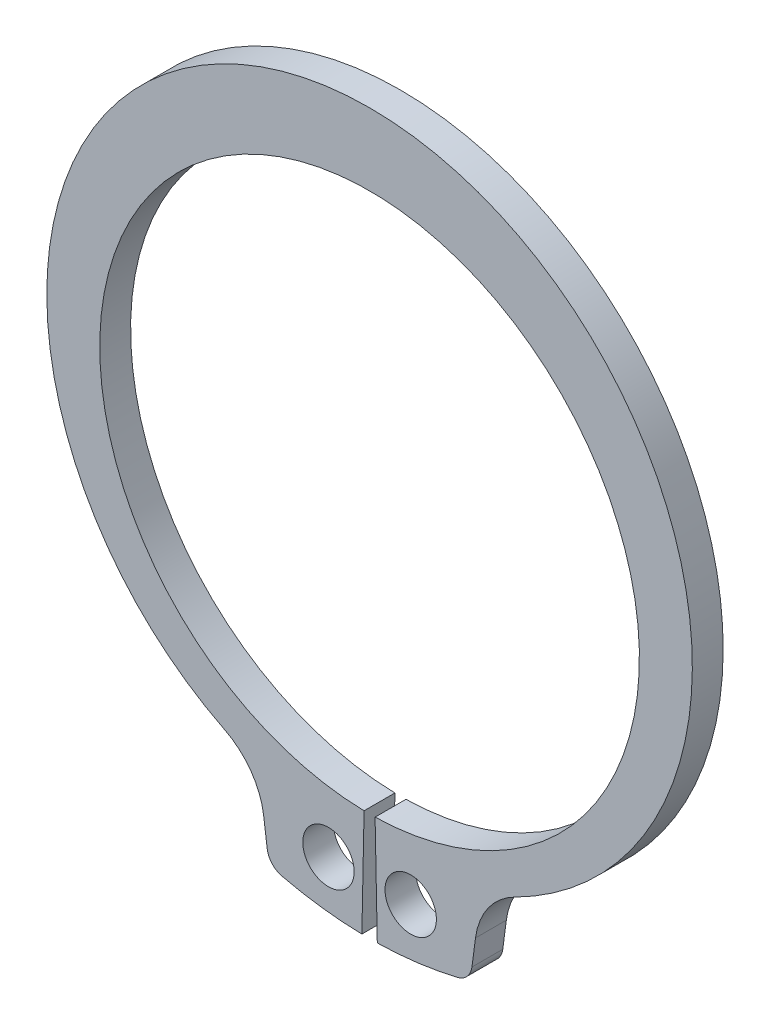
from build123d import *

# Parameters (mm, degrees)
BODYSKE_R  = 1
BODY_DEPTH = 1.2


with BuildPart() as part:
    # BodySke → Body (new body)
    with BuildSketch(Plane.XY):
        with BuildLine():
            Line((0.214285714, -10.497813183), (0.3, -14.696938457))
            ThreePointArc((0.3, -14.696938457), (1.86755937, -14.580885501), (3.413765605, -14.298118911))
            ThreePointArc((3.413765605, -14.298118911), (3.796638548, -14.070819474), (3.983177537, -13.666517692))
            Line((3.983177537, -13.666517692), (4.121423858, -12.616432629))
            ThreePointArc((4.121423858, -12.616432629), (4.615201874, -11.359967763), (5.639656061, -10.480755443))
            ThreePointArc((5.639656061, -10.480755443), (0, 13.3), (-5.639656061, -10.480755443))
            ThreePointArc((-5.639656061, -10.480755443), (-4.615201874, -11.359967763), (-4.121423858, -12.616432629))
            Line((-4.121423858, -12.616432629), (-3.983177537, -13.666517692))
            ThreePointArc((-3.983177537, -13.666517692), (-3.796638548, -14.070819474), (-3.413765605, -14.298118911))
            ThreePointArc((-3.413765605, -14.298118911), (-1.86755937, -14.580885501), (-0.3, -14.696938457))
            Line((-0.3, -14.696938457), (-0.214285714, -10.497813183))
            ThreePointArc((-0.214285714, -10.497813183), (0, 10.5), (0.214285714, -10.497813183))
        make_face()
        with Locations((1.6, -12.75)):
            Circle(BODYSKE_R, mode=Mode.SUBTRACT)
        with Locations((-1.6, -12.75)):
            Circle(BODYSKE_R, mode=Mode.SUBTRACT)
    extrude(amount=-BODY_DEPTH)


solid = part.part
